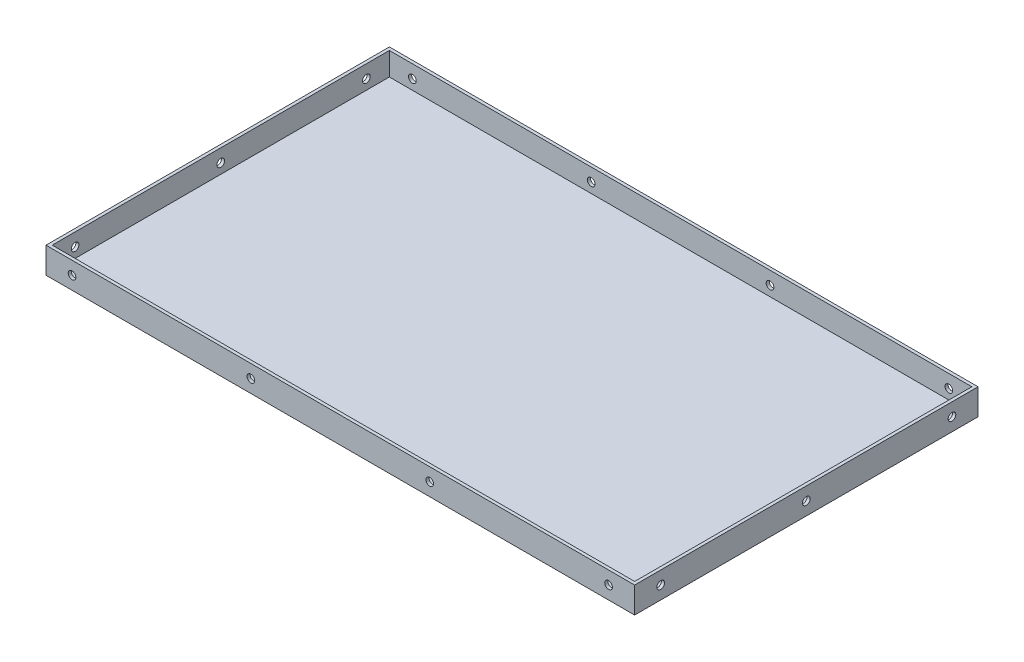
from build123d import *

# Parameters (mm, degrees)
SKETCH_1_W          = 384
SKETCH_1_H          = 224
EXTRUDE_1_DEPTH     = 2
SKETCH_2_W          = 384
SKETCH_2_H          = 224
SKETCH_2_W_2        = 380
SKETCH_2_H_2        = 220
EXTRUDE_2_DEPTH     = 15
SKETCH_3_R          = 2.5
CUT_EXTRUDE_1_DEPTH = 296.514805044
SKETCH_4_R          = 2.5
CUT_EXTRUDE_2_DEPTH = 401.36108702


with BuildPart() as part:
    # 草图1 → 凸台-拉伸1 (new body)
    with BuildSketch(Plane(origin=(0, 0, 0), x_dir=(1, 0, 0), z_dir=(0, 1, 0))):
        Rectangle(SKETCH_1_W, SKETCH_1_H)
    extrude(amount=EXTRUDE_1_DEPTH)

    # 草图2 → 凸台-拉伸2 (add)
    with BuildSketch(Plane(origin=(0, 2, 0), x_dir=(1, 0, 0), z_dir=(0, 1, 0))):
        Rectangle(SKETCH_2_W, SKETCH_2_H)
        Rectangle(SKETCH_2_W_2, SKETCH_2_H_2, mode=Mode.SUBTRACT)
    extrude(amount=EXTRUDE_2_DEPTH)

    # 草图3 → 切除-拉伸1 (cut, through all)
    with BuildSketch(Plane(origin=(0, 0, -112), x_dir=(-1, 0, 0), z_dir=(0, 0, -1))):
        with Locations((-175, 8.5)):
            Circle(SKETCH_3_R)
        with Locations((-58.33, 8.5)):
            Circle(SKETCH_3_R)
        with Locations((58.34, 8.5)):
            Circle(SKETCH_3_R)
        with Locations((175.01, 8.5)):
            Circle(SKETCH_3_R)
    extrude(amount=-CUT_EXTRUDE_1_DEPTH, mode=Mode.SUBTRACT)

    # 草图4 → 切除-拉伸2 (cut, through all)
    with BuildSketch(Plane(origin=(192, 0, 0), x_dir=(0, 0, -1), z_dir=(1, 0, 0))):
        with Locations((-95, 8.5)):
            Circle(SKETCH_4_R)
        with Locations((0, 8.5)):
            Circle(SKETCH_4_R)
        with Locations((95, 8.5)):
            Circle(SKETCH_4_R)
    extrude(amount=-CUT_EXTRUDE_2_DEPTH, mode=Mode.SUBTRACT)


solid = part.part
